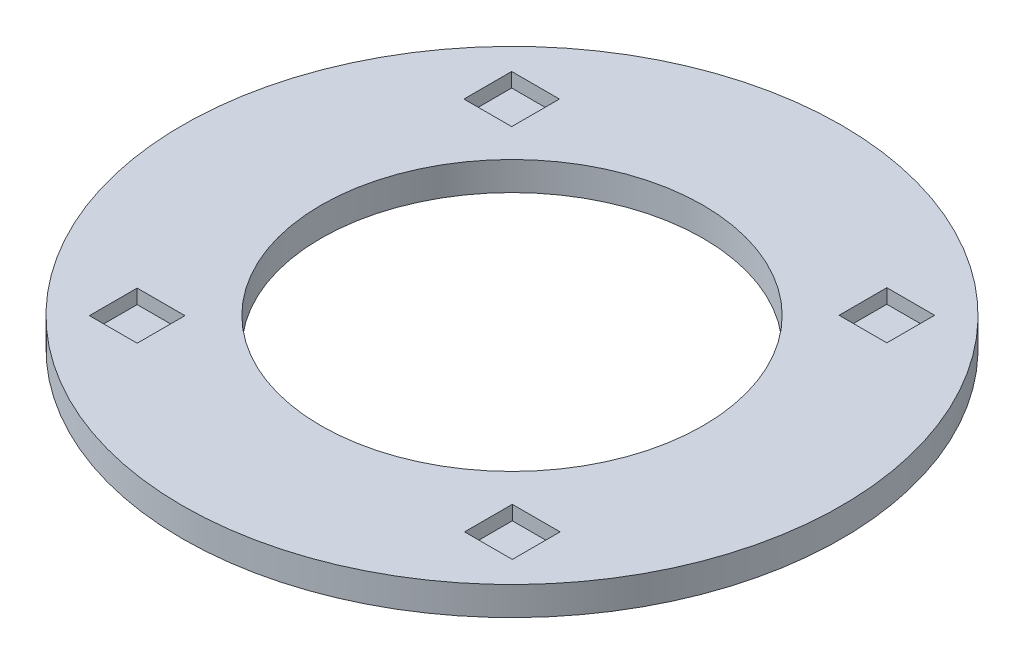
from build123d import *

# Parameters (mm, degrees)
SKETCH1_R           = 34.5
BOSS_EXTRUDE1_DEPTH = 3
SKETCH4_R           = 20
CUT_EXTRUDE2_DEPTH  = 49.88251221
SKETCH5_W           = 5
SKETCH5_H           = 5
CUT_EXTRUDE3_DEPTH  = 1.5


with BuildPart() as part:
    # Sketch1 → Boss-Extrude1 (new body)
    with BuildSketch(Plane(origin=(0, 0, 0), x_dir=(1, 0, 0), z_dir=(0, 1, 0))):
        with Locations(Location((0, 0, 0), (0, 0, 270))):
            Circle(SKETCH1_R)
    extrude(amount=BOSS_EXTRUDE1_DEPTH)

    # Sketch4 → Cut-Extrude2 (cut, through all)
    with BuildSketch(Plane(origin=(0, 3, 0), x_dir=(1, 0, 0), z_dir=(0, 1, 0))):
        with Locations(Location((0, 0, 0), (0, 0, 270))):
            Circle(SKETCH4_R)
    extrude(amount=-CUT_EXTRUDE2_DEPTH, mode=Mode.SUBTRACT)

    # Sketch5 → Cut-Extrude3 (cut)
    with BuildSketch(Plane(origin=(0, 3, 0), x_dir=(1, 0, 0), z_dir=(0, 1, 0))):
        with Locations((19.603168608, 19.636741271)):
            Rectangle(SKETCH5_W, SKETCH5_H)
        with Locations((-19.636741271, 19.603168608)):
            Rectangle(SKETCH5_W, SKETCH5_H)
        with Locations((19.636741271, -19.603168608)):
            Rectangle(SKETCH5_W, SKETCH5_H)
        with Locations((-19.603168608, -19.636741271)):
            Rectangle(SKETCH5_W, SKETCH5_H)
    extrude(amount=-CUT_EXTRUDE3_DEPTH, mode=Mode.SUBTRACT)


solid = part.part
